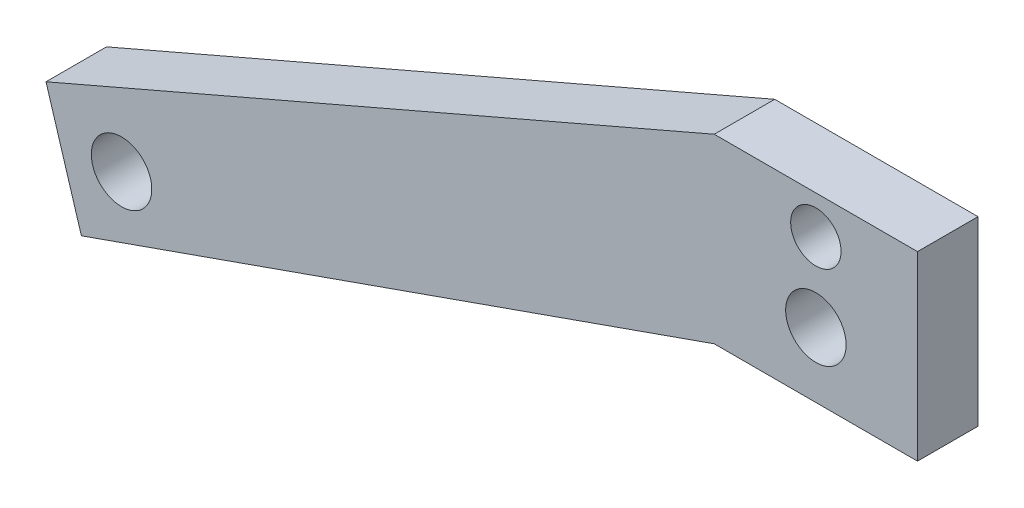
from build123d import *

# Parameters (mm, degrees)
SKETCH1_R           = 3.96875
SKETCH1_R_2         = 4.762500002
BOSS_EXTRUDE1_DEPTH = 9.525


with BuildPart() as part:
    # Sketch1 → Boss-Extrude1 (new body)
    with BuildSketch(Plane.XY):
        Polygon((-15.999993773, 44.99997758), (-121.199270656, -0.446548924), (-115.629589681, -18.664154525), (-15.999993773, 16.42497758), (16.000006227, 16.42497758), (16.000006227, 44.99997758), align=None)
        with Locations(Location((6.227e-06, 38.99997758, 0), (0, 0, 180))):
            Circle(SKETCH1_R, mode=Mode.SUBTRACT)
        with Locations(Location((6.239e-06, 26.647574613, 0), (0, 0, 180))):
            Circle(SKETCH1_R_2, mode=Mode.SUBTRACT)
        with Locations(Location((-109.305627368, -6.770511237, 0), (0, 0, 180))):
            Circle(SKETCH1_R_2, mode=Mode.SUBTRACT)
    extrude(amount=BOSS_EXTRUDE1_DEPTH)


solid = part.part
